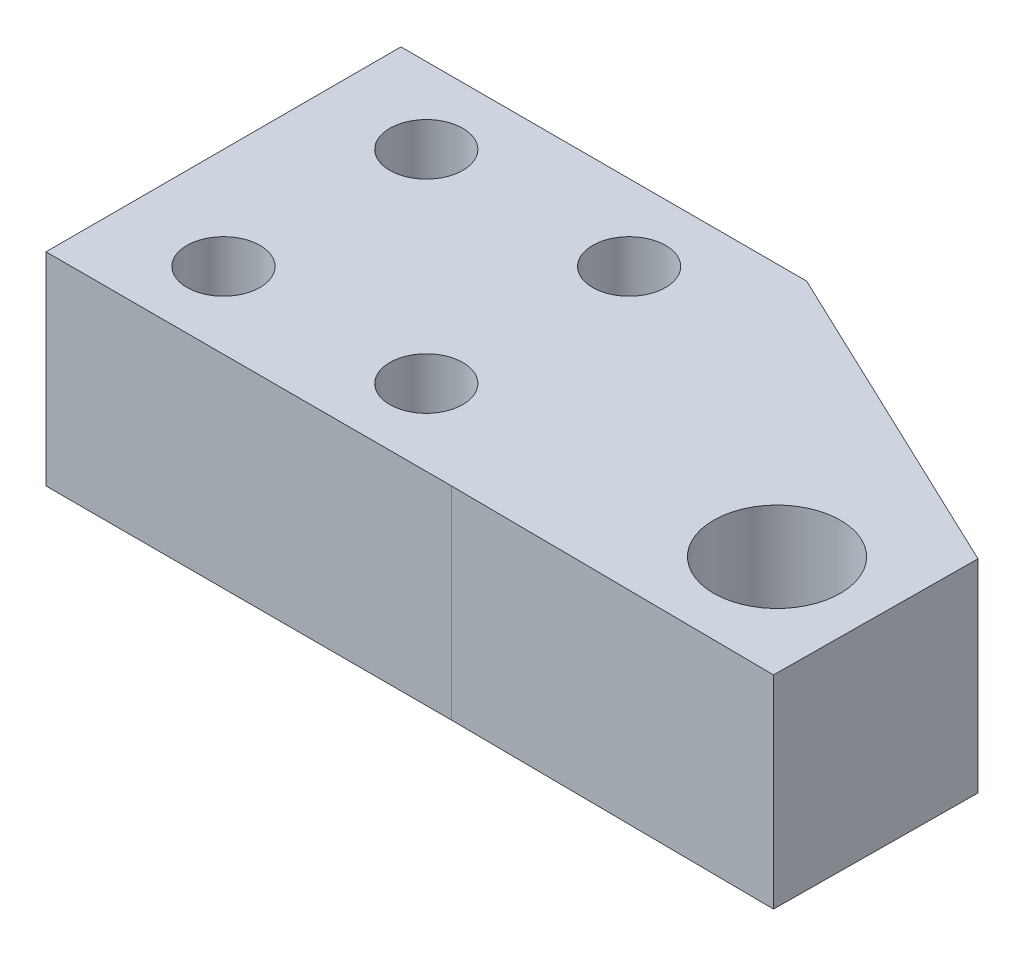
from build123d import *

# Parameters (mm, degrees)
SKETCH1_R           = 3.96875
SKETCH1_R_2         = 2.286
BOSS_EXTRUDE1_DEPTH = 6.35


with BuildPart() as part:
    # Sketch1 → Boss-Extrude1 (new, symmetric)
    with BuildSketch(Plane(origin=(0, 0, 0), x_dir=(1, 0, 0), z_dir=(0, 1, 0))):
        Polygon((25.4, 22.225), (45.823533094, 12.53282474), (45.719315816, -0.166747645), (25.4, 0), (0, 0), (0, 22.225), align=None)
        with Locations(Location((39.422580786, 6.35, 0), (0, 0, 270))):
            Circle(SKETCH1_R, mode=Mode.SUBTRACT)
        with Locations(Location((6.35, 4.7625, 0), (0, 0, 270))):
            Circle(SKETCH1_R_2, mode=Mode.SUBTRACT)
        with Locations(Location((19.05, 4.7625, 0), (0, 0, 270))):
            Circle(SKETCH1_R_2, mode=Mode.SUBTRACT)
        with Locations(Location((19.05, 17.4625, 0), (0, 0, 270))):
            Circle(SKETCH1_R_2, mode=Mode.SUBTRACT)
        with Locations(Location((6.35, 17.4625, 0), (0, 0, 270))):
            Circle(SKETCH1_R_2, mode=Mode.SUBTRACT)
    extrude(amount=BOSS_EXTRUDE1_DEPTH, both=True)


solid = part.part
